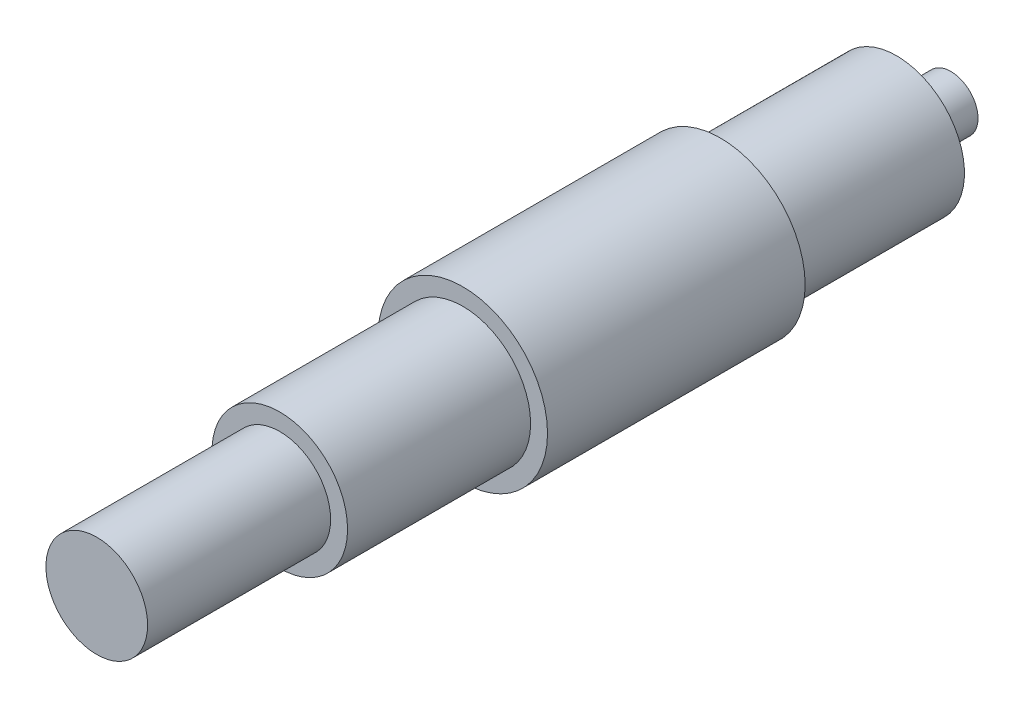
from build123d import *

# Parameters (mm, degrees)
SKETCH1_R           = 4
BOSS_EXTRUDE1_DEPTH = 8
SKETCH2_R           = 10
BOSS_EXTRUDE2_DEPTH = 26
SKETCH3_R           = 12.5
BOSS_EXTRUDE3_DEPTH = 38
SKETCH4_R           = 10
BOSS_EXTRUDE4_DEPTH = 20
SKETCH5_R           = 7.5
BOSS_EXTRUDE5_DEPTH = 34
SKETCH8_R           = 10
SKETCH8_R_2         = 7.5
BOSS_EXTRUDE6_DEPTH = 7


with BuildPart() as part:
    # Sketch1 → Boss-Extrude1 (new body)
    with BuildSketch(Plane.XY):
        Circle(SKETCH1_R)
    extrude(amount=BOSS_EXTRUDE1_DEPTH)

    # Sketch2 → Boss-Extrude2 (add)
    with BuildSketch(Plane.XY.offset(8)):
        with Locations(Location((0, 0, 0), (0, 0, 180))):
            Circle(SKETCH2_R)
    extrude(amount=BOSS_EXTRUDE2_DEPTH)

    # Sketch3 → Boss-Extrude3 (add)
    with BuildSketch(Plane.XY.offset(34)):
        Circle(SKETCH3_R)
    extrude(amount=BOSS_EXTRUDE3_DEPTH)

    # Sketch4 → Boss-Extrude4 (add)
    with BuildSketch(Plane.XY.offset(72)):
        with Locations(Location((0, 0, 0), (0, 0, 180))):
            Circle(SKETCH4_R)
    extrude(amount=BOSS_EXTRUDE4_DEPTH)

    # Sketch5 → Boss-Extrude5 (add)
    with BuildSketch(Plane.XY.offset(92)):
        Circle(SKETCH5_R)
    extrude(amount=BOSS_EXTRUDE5_DEPTH)

    # Sketch8 → Boss-Extrude6 (add)
    with BuildSketch(Plane.XY.offset(92)):
        with Locations(Location((0, 0, 0), (0, 0, 180))):
            Circle(SKETCH8_R)
        Circle(SKETCH8_R_2, mode=Mode.SUBTRACT)
    extrude(amount=BOSS_EXTRUDE6_DEPTH)


solid = part.part
